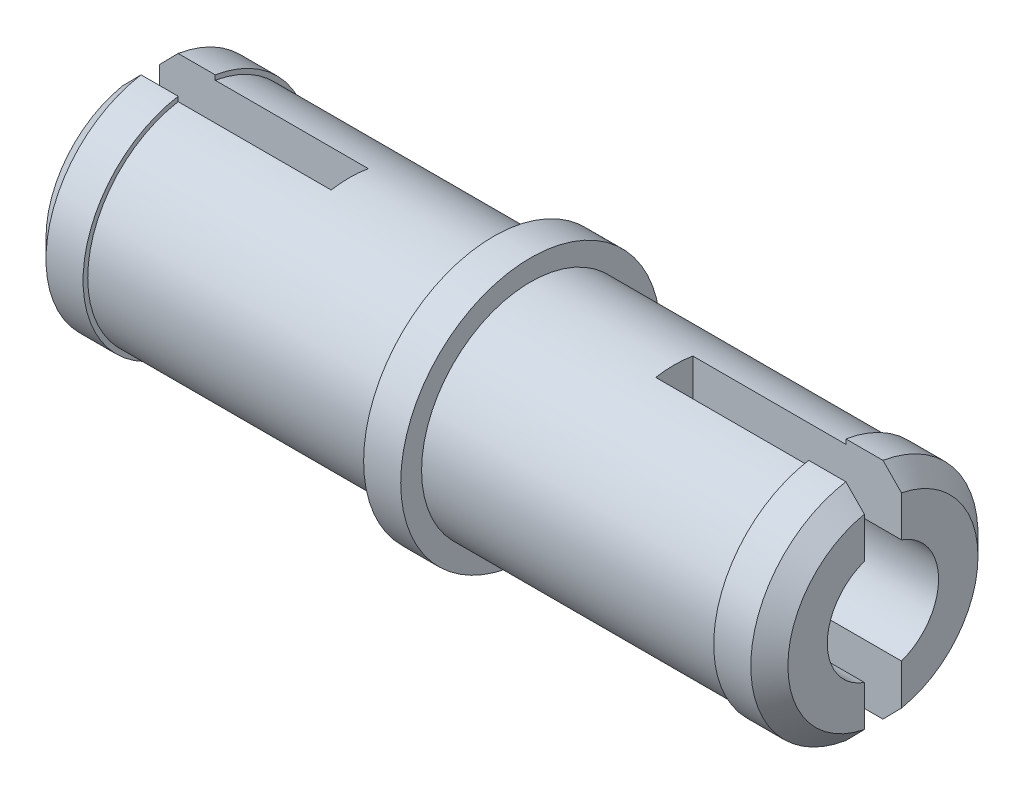
from build123d import *

# Parameters (mm, degrees)
CUT_EXTRUDE1_DEPTH      = 9.926365442
CUT_EXTRUDE1_DEPTH_BACK = 9.926365442
SKETCH2_W               = 6.910571645
SKETCH2_H               = 0.8
SKETCH2_W_2             = 6.017195094
CHAMFER1_SIZE           = 0.4
CUT_EXTRUDE2_DEPTH      = 17.482718222
CUT_EXTRUDE2_DEPTH_BACK = 17.482718222
SKETCH3_R               = 1.2


with BuildPart() as part:
    # Sketch1 → Revolve1 (revolve)
    with BuildSketch(Plane.XY, mode=Mode.PRIVATE) as revolve1_sk:
        Polygon((-8, 0), (-8, 2.45), (-6.8, 2.45), (-6.8, 2.35), (-0.4, 2.35), (-0.4, 2.8), (0.4, 2.8), (0.4, 2.35), (6.8, 2.35), (6.8, 2.45), (8, 2.45), (8, 0), align=None)
    revolve(revolve1_sk.sketch.rotate(Axis((-8, 0, 0), (1, 0, 0)), 90), axis=Axis((-8, 0, 0), (1, 0, 0)))

    # Sketch2 → Cut-Extrude1 (cut, two sides: drawn at the far end of the back side and taken through both)
    with BuildSketch(Plane(origin=(0, 0, 0), x_dir=(1, 0, 0), z_dir=(0, 1, 0)).offset(-CUT_EXTRUDE1_DEPTH_BACK)):
        with Locations((-6.955285823, 0)):
            Rectangle(SKETCH2_W, SKETCH2_H)
        with Locations((6.508597547, 0)):
            Rectangle(SKETCH2_W_2, SKETCH2_H)
    extrude(amount=CUT_EXTRUDE1_DEPTH + CUT_EXTRUDE1_DEPTH_BACK, mode=Mode.SUBTRACT)

    # Chamfer1
    chamfer1_edges = [part.edges().sort_by_distance(p)[0] for p in [
        (8, 0, -2.45),
        (8, 0, 2.45),
        (-8, 0, -2.45),
        (-8, 0, 2.45),
    ]]
    chamfer(chamfer1_edges, length=CHAMFER1_SIZE)

    # Sketch3 → Cut-Extrude2 (cut, two sides: drawn at the far end of the back side and taken through both)
    with BuildSketch(Plane(origin=(8, 0, 0), x_dir=(0, 0, -1), z_dir=(1, 0, 0)).offset(-CUT_EXTRUDE2_DEPTH_BACK)):
        with Locations(Location((0, 0, 0), (0, 0, 289.471220634))):
            Circle(SKETCH3_R)
    extrude(amount=CUT_EXTRUDE2_DEPTH + CUT_EXTRUDE2_DEPTH_BACK, mode=Mode.SUBTRACT)


solid = part.part
